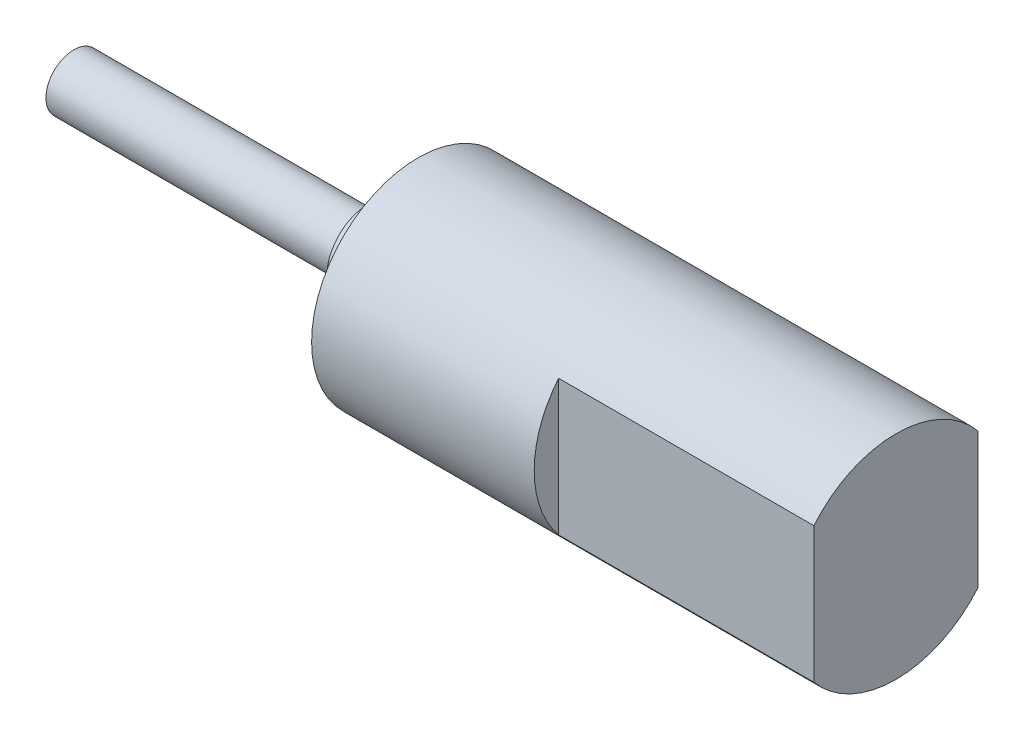
from build123d import *

# Parameters (mm, degrees)
BOSS_EXTRUDE1_DEPTH = 18.36
BOSS_EXTRUDE2_START = 16.01
SKETCH2_R           = 7.655
BOSS_EXTRUDE2_DEPTH = 16.01
SKETCH3_R           = 3.005
BOSS_EXTRUDE3_DEPTH = 3.56
SKETCH4_R           = 2
BOSS_EXTRUDE4_DEPTH = 21.2
CUT_EXTRUDE1_START  = -21.2
CUT_EXTRUDE1_DEPTH  = 21.2


with BuildPart() as part:
    # Sketch1 → Boss-Extrude1 (new body)
    with BuildSketch(Plane(origin=(0, 0, 0), x_dir=(0, 0, -1), z_dir=(1, 0, 0))):
        with BuildLine():
            Line((-5.9, 0), (-5.9, 4.87739941))
            ThreePointArc((-5.9, 4.87739941), (0, 7.655), (5.9, 4.87739941))
            Line((5.9, 4.87739941), (5.9, 0))
            Line((5.9, 0), (5.9, -4.87739941))
            ThreePointArc((5.9, -4.87739941), (0, -7.655), (-5.9, -4.87739941))
            Line((-5.9, -4.87739941), (-5.9, 0))
        make_face()
    extrude(amount=BOSS_EXTRUDE1_DEPTH)

    # Sketch2 → Boss-Extrude2 (add)
    with BuildSketch(Plane.ZY.offset(BOSS_EXTRUDE2_START)):
        Circle(SKETCH2_R)
    extrude(amount=-BOSS_EXTRUDE2_DEPTH)

    # Sketch3 → Boss-Extrude3 (add)
    with BuildSketch(Plane.ZY.offset(16.01)):
        Circle(SKETCH3_R)
    extrude(amount=BOSS_EXTRUDE3_DEPTH)

    # Sketch4 → Boss-Extrude4 (add)
    with BuildSketch(Plane.ZY.offset(19.57)):
        Circle(SKETCH4_R)
    extrude(amount=BOSS_EXTRUDE4_DEPTH)

    # Sketch5 → Cut-Extrude1 (cut)
    with BuildSketch(Plane.ZY.offset(40.77).offset(CUT_EXTRUDE1_START)):
        with BuildLine():
            Line((-1.5, -1.322875656), (-1.5, 0))
            Line((-1.5, 0), (-1.5, 1.322875656))
            ThreePointArc((-1.5, 1.322875656), (-2, 0), (-1.5, -1.322875656))
        make_face()
    extrude(amount=CUT_EXTRUDE1_DEPTH, mode=Mode.SUBTRACT)


solid = part.part
